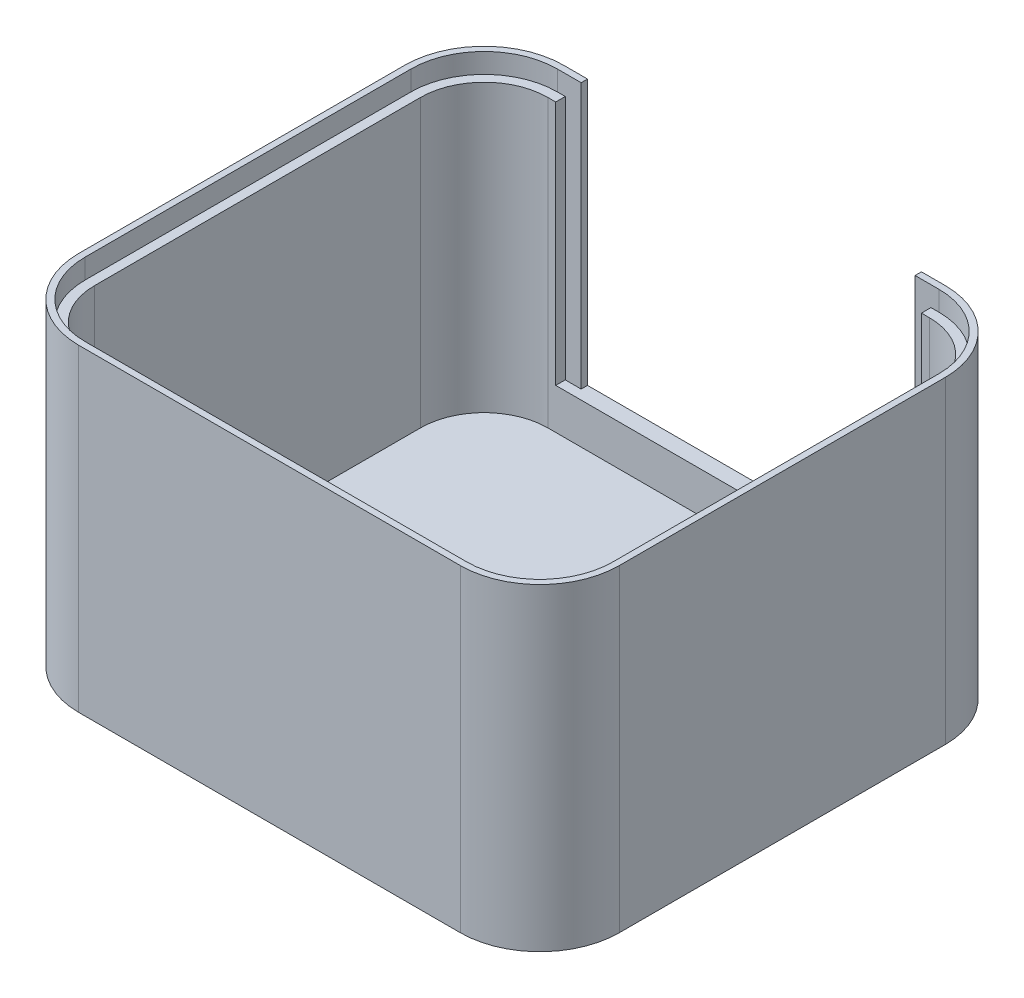
from build123d import *

# Parameters (mm, degrees)
SKETCH1_W                = 136
SKETCH1_H                = 122
BOSS_EXTRUDE1_DEPTH      = 80
FILLET1_R                = 20
SHELL1_T                 = -4
SHELL1_THICKNESS_2_DEPTH = 1
CUT_EXTRUDE2_DEPTH       = 5
F_4_CLEARANCE_HOLE1_D    = 3.2639
CUT_EXTRUDE3_DEPTH       = 66.75


with BuildPart() as part:
    # Sketch1 → Boss-Extrude1 (new body)
    with BuildSketch(Plane(origin=(0, 0, 0), x_dir=(1, 0, 0), z_dir=(0, 1, 0))):
        Rectangle(SKETCH1_W, SKETCH1_H)
    extrude(amount=BOSS_EXTRUDE1_DEPTH)

    # Fillet1
    fillet1_edges = [part.edges().sort_by_distance(p)[0] for p in [
        (68, 40, 61),
        (-68, 40, 61),
        (-68, 40, -61),
        (68, 40, -61),
    ]]
    fillet(fillet1_edges, radius=FILLET1_R)

    # Shell1
    shell1_openings = [part.faces().sort_by_distance(p)[0] for p in [
        (0, 80, 0),
    ]]
    offset(amount=SHELL1_T, openings=shell1_openings, kind=Kind.INTERSECTION)

    # Shell1 thickness 2 face (on inner face of the shell) → Shell1 thickness 2 (cut)
    with BuildSketch(Plane(origin=(0, 4, 0), x_dir=(0, 0, -1), z_dir=(0, -1, 0))):
        with BuildLine():
            ThreePointArc((57, -48), (52.313708499, -59.313708499), (41, -64))
            Line((41, -64), (-41, -64))
            ThreePointArc((-41, -64), (-52.313708499, -59.313708499), (-57, -48))
            Line((-57, -48), (-57, 48))
            ThreePointArc((-57, 48), (-52.313708499, 59.313708499), (-41, 64))
            Line((-41, 64), (41, 64))
            ThreePointArc((41, 64), (52.313708499, 59.313708499), (57, 48))
            Line((57, 48), (57, -48))
        make_face()
    extrude(amount=SHELL1_THICKNESS_2_DEPTH, mode=Mode.SUBTRACT)

    # Sketch5 → Cut-Extrude2 (cut)
    with BuildSketch(Plane(origin=(0, 80, 0), x_dir=(1, 0, 0), z_dir=(0, 1, 0))):
        with BuildLine():
            Line((48, 59.4), (-48, 59.4))
            ThreePointArc((-48, 59.4), (-61.010764774, 54.010764774), (-66.4, 41))
            Line((-66.4, 41), (-66.4, -41))
            ThreePointArc((-66.4, -41), (-61.010764774, -54.010764774), (-48, -59.4))
            Line((-48, -59.4), (48, -59.4))
            ThreePointArc((48, -59.4), (61.010764774, -54.010764774), (66.4, -41))
            Line((66.4, -41), (66.4, 41))
            ThreePointArc((66.4, 41), (61.010764774, 54.010764774), (48, 59.4))
        make_face()
        with BuildLine():
            Line((48, 57), (-48, 57))
            ThreePointArc((-48, 57), (-59.313708499, 52.313708499), (-64, 41))
            Line((-64, 41), (-64, -41))
            ThreePointArc((-64, -41), (-59.313708499, -52.313708499), (-48, -57))
            Line((-48, -57), (48, -57))
            ThreePointArc((48, -57), (59.313708499, -52.313708499), (64, -41))
            Line((64, -41), (64, 41))
            ThreePointArc((64, 41), (59.313708499, 52.313708499), (48, 57))
        make_face(mode=Mode.SUBTRACT)
    extrude(amount=-CUT_EXTRUDE2_DEPTH, mode=Mode.SUBTRACT)

    # #4 Clearance Hole1 (through all)
    with Locations(Plane(origin=(0, 3, 0), x_dir=(1, 0, 0), z_dir=(0, 1, 0))):
        with Locations((-25.4, 0), (25.4, 0)):
            Hole(F_4_CLEARANCE_HOLE1_D / 2)

    # Sketch8 → Cut-Extrude3 (cut)
    with BuildSketch(Plane(origin=(0, 80, 0), x_dir=(1, 0, 0), z_dir=(0, 1, 0))):
        Polygon((42, 61), (-42, 61), (-42, 59.4), (-46, 59.4), (-46, 57), (46, 57), (46, 59.4), (42, 59.4), align=None)
    extrude(amount=-CUT_EXTRUDE3_DEPTH, mode=Mode.SUBTRACT)


solid = part.part
